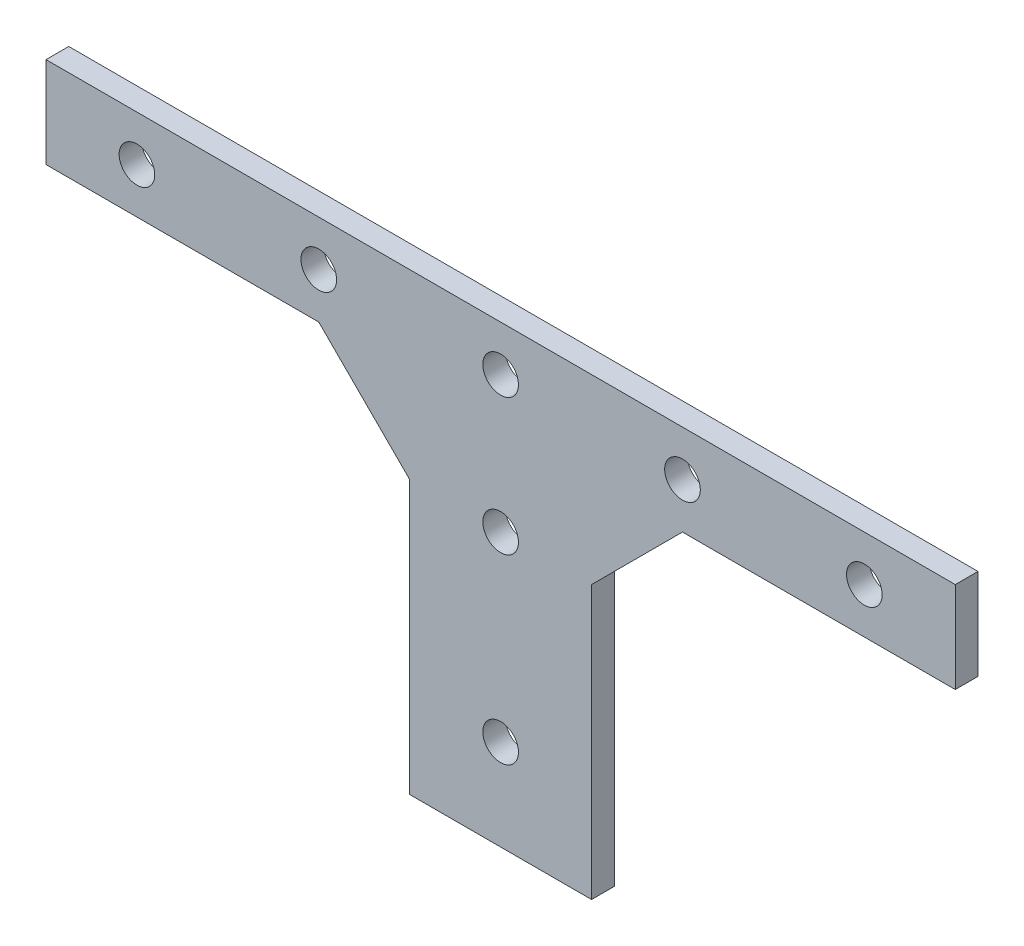
from build123d import *

# Parameters (mm, degrees)
BOSS_EXTRUDE1_DEPTH    = 3.175
F_10_CLEARANCE_HOLE1_D = 4.9784


with BuildPart() as part:
    # Sketch1 → Boss-Extrude1 (new body)
    with BuildSketch(Plane.XY):
        Polygon((41.275, -25.4), (41.275, -63.5), (66.675, -63.5), (66.675, -25.4), (79.375, -12.7), (117.475, -12.7), (117.475, 0), (-9.525, 0), (-9.525, -12.7), (28.575, -12.7), align=None)
    extrude(amount=BOSS_EXTRUDE1_DEPTH)

    # #10 Clearance Hole1 (through all)
    with Locations(Plane.XY.offset(3.175)):
        with Locations((3.175, -6.35), (28.575, -6.35), (53.975, -6.35), (104.775, -6.35), (53.975, -25.4), (53.975, -50.8), (79.375, -6.35)):
            Hole(F_10_CLEARANCE_HOLE1_D / 2)


solid = part.part
